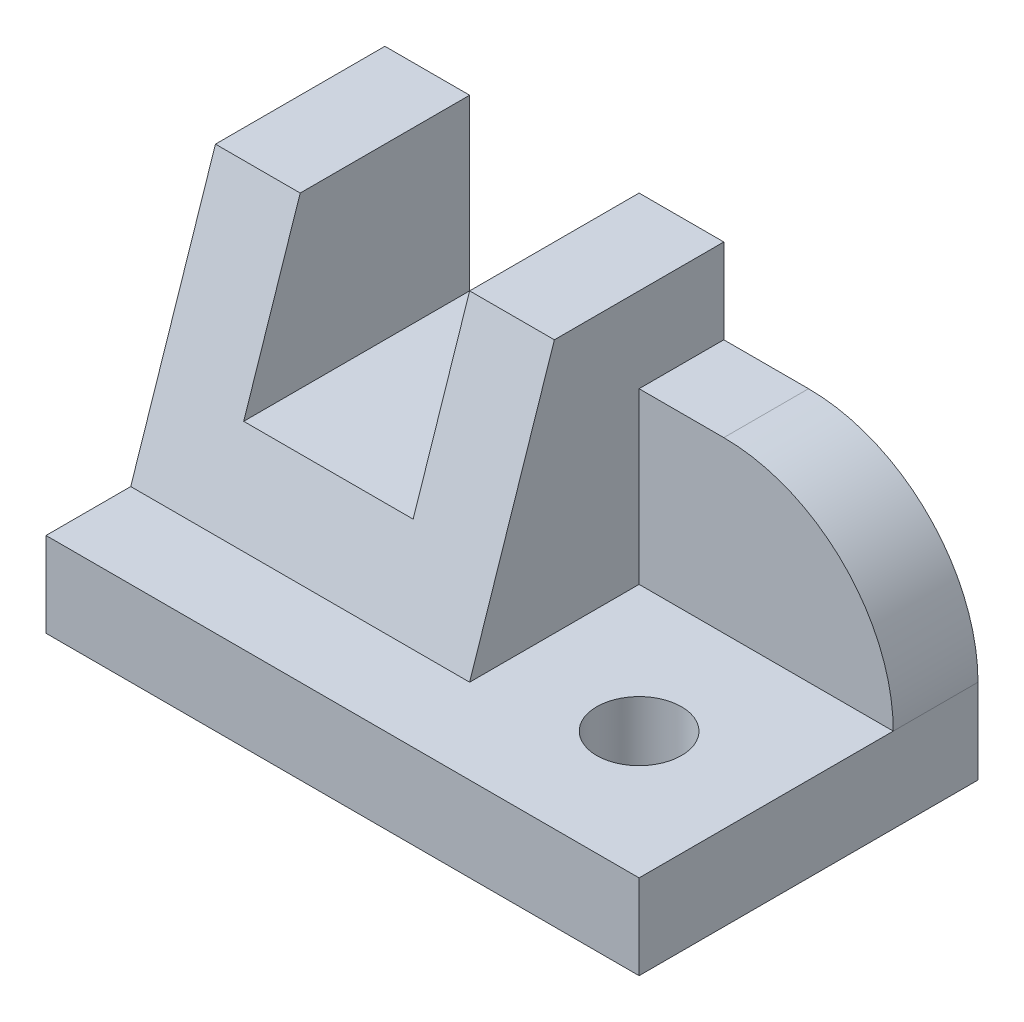
from build123d import *

# Parameters (mm, degrees)
BOSS_EXTRUDE1_DEPTH            = 40
SKETCH2_W                      = 40
SKETCH2_H                      = 30
BOSS_EXTRUDE2_DEPTH            = 20
BOSS_EXTRUDE3_DEPTH            = 30
CUT_EXTRUDE1_DEPTH             = 30
SKETCH5_W                      = 70
SKETCH5_H                      = 40
BOSS_EXTRUDE4_DEPTH            = 10
SKETCH6_W                      = 20
SKETCH6_H                      = 20
CUT_EXTRUDE2_DEPTH             = 91
F_10_0_10_DIAMETER_HOLE1_D     = 10
F_10_0_10_DIAMETER_HOLE1_DEPTH = 40
FILLET1_R                      = 20


with BuildPart() as part:
    # Sketch1 → Boss-Extrude1 (new body)
    with BuildSketch(Plane(origin=(0, 0, 0), x_dir=(0, -1, 0), z_dir=(-1, 0, 0))):
        Polygon((-10, -10), (-40, -20), (-10, -20), align=None)
    extrude(amount=-BOSS_EXTRUDE1_DEPTH)

    # Sketch2 → Boss-Extrude2 (add)
    with BuildSketch(Plane(origin=(0, 0, -20), x_dir=(-1, 0, 0), z_dir=(0, 0, -1))):
        with Locations((-20, 25)):
            Rectangle(SKETCH2_W, SKETCH2_H)
    extrude(amount=BOSS_EXTRUDE2_DEPTH)

    # Sketch3 → Boss-Extrude3 (add)
    with BuildSketch(Plane(origin=(40, 0, 0), x_dir=(0, 0, -1), z_dir=(1, 0, 0))):
        Polygon((40, 10), (0, 10), (20, 40), (40, 40), align=None)
    extrude(amount=BOSS_EXTRUDE3_DEPTH)

    # Sketch4 → Cut-Extrude1 (cut)
    with BuildSketch(Plane(origin=(70, 0, 0), x_dir=(0, 0, -1), z_dir=(1, 0, 0))):
        Polygon((20, 40), (0, 10), (30, 10), (30, 30), (40, 30), (40, 40), align=None)
    extrude(amount=-CUT_EXTRUDE1_DEPTH, mode=Mode.SUBTRACT)

    # Sketch5 → Boss-Extrude4 (add)
    with BuildSketch(Plane.XZ.offset(-10)):
        with Locations((35, -20)):
            Rectangle(SKETCH5_W, SKETCH5_H)
    extrude(amount=BOSS_EXTRUDE4_DEPTH)

    # Sketch6 → Cut-Extrude2 (cut, through all)
    with BuildSketch(Plane(origin=(0, 0, -40), x_dir=(-1, 0, 0), z_dir=(0, 0, -1))):
        with Locations((-20, 30)):
            Rectangle(SKETCH6_W, SKETCH6_H)
    extrude(amount=-CUT_EXTRUDE2_DEPTH, mode=Mode.SUBTRACT)

    # Ø10.0 (10) Diameter Hole1
    with Locations(Plane(origin=(0, 0, 0), x_dir=(-1, 0, 0), z_dir=(0, -1, 0))):
        with Locations((-55, 15)):
            Hole(F_10_0_10_DIAMETER_HOLE1_D / 2, depth=F_10_0_10_DIAMETER_HOLE1_DEPTH)

    # Fillet1
    fillet1_edges = [part.edges().sort_by_distance(p)[0] for p in [
        (70, 30, -35),
    ]]
    fillet(fillet1_edges, radius=FILLET1_R)


solid = part.part
